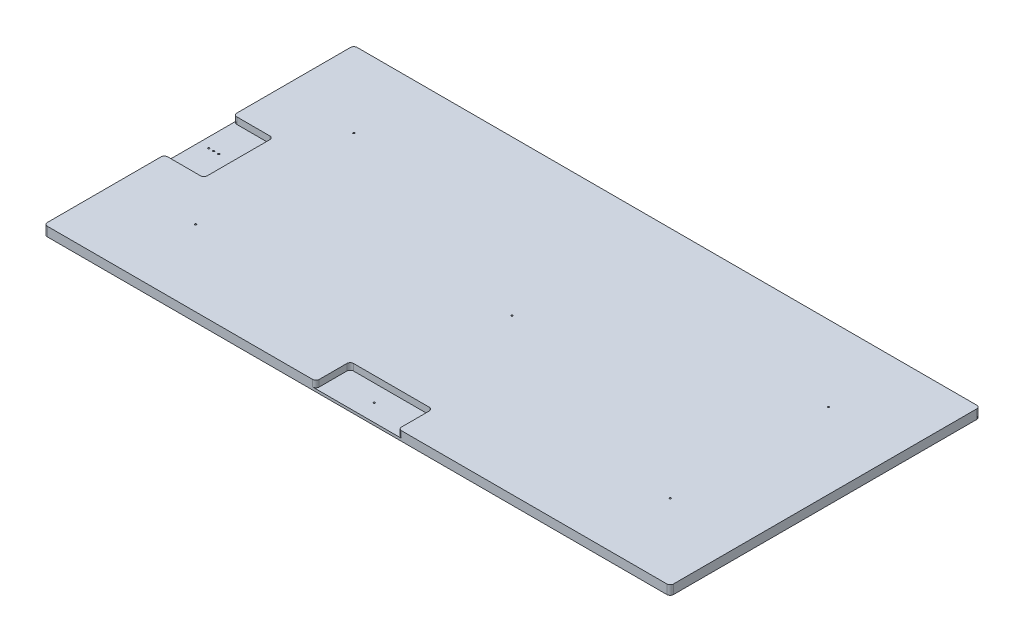
from build123d import *

# Parameters (mm, degrees)
SKETCH1_W                             = 1206.5
SKETCH1_H                             = 596.9
BOSS_EXTRUDE1_DEPTH                   = 17.78
F_1_8_0_125_DIAMETER_HOLE1_D          = 3.175
FILLET1_R                             = 6.35
SKETCH4_W                             = 158.75
SKETCH4_H                             = 66.04
SKETCH4_W_2                           = 76.2
SKETCH4_H_2                           = 133.35
CUT_EXTRUDE1_DEPTH                    = 12.7
FILLET2_R                             = 6.35
SKETCH6_W                             = 1.5875
SKETCH6_H                             = 5.08
F_1_8_0_125_DIAMETER_HOLE2_AT_2_COUNT = 2
F_1_8_0_125_DIAMETER_HOLE2_AT_2_PITCH = 1123.95
F_1_8_0_125_DIAMETER_HOLE2_AT_3_COUNT = 2
F_1_8_0_125_DIAMETER_HOLE2_AT_3_PITCH = 1133.602
F_1_8_0_125_DIAMETER_HOLE2_AT_4_COUNT = 2
F_1_8_0_125_DIAMETER_HOLE2_AT_4_PITCH = 1143.254
F_1_8_0_125_DIAMETER_HOLE2_AT_5_COUNT = 2
F_1_8_0_125_DIAMETER_HOLE2_AT_5_PITCH = 618.636019724
F_1_8_0_125_DIAMETER_HOLE2_AT_6_COUNT = 2
F_1_8_0_125_DIAMETER_HOLE2_AT_6_PITCH = 19.05
F_1_8_0_125_DIAMETER_HOLE2_AT_7_COUNT = 2
F_1_8_0_125_DIAMETER_HOLE2_AT_7_PITCH = 9.525


with BuildPart() as part:
    # Sketch1 → Boss-Extrude1 (new body)
    with BuildSketch(Plane(origin=(0, 0, 0), x_dir=(1, 0, 0), z_dir=(0, 1, 0))):
        Rectangle(SKETCH1_W, SKETCH1_H)
    extrude(amount=BOSS_EXTRUDE1_DEPTH)

    # 1/8 (0.125) Diameter Hole1 (through all)
    with Locations(Plane(origin=(0, 17.78, 0), x_dir=(1, 0, 0), z_dir=(0, 1, 0))):
        with Locations((0, 0), (457.2, 152.4), (-457.2, -152.4), (-457.2, 152.4), (457.2, -152.4)):
            Hole(F_1_8_0_125_DIAMETER_HOLE1_D / 2)

    # Fillet1
    fillet1_edges = [part.edges().sort_by_distance(p)[0] for p in [
        (603.25, 8.89, 298.45),
        (-603.25, 8.89, 298.45),
        (-603.25, 8.89, -298.45),
        (603.25, 8.89, -298.45),
    ]]
    fillet(fillet1_edges, radius=FILLET1_R)

    # Sketch4 → Cut-Extrude1 (cut)
    with BuildSketch(Plane(origin=(0, 17.78, 0), x_dir=(1, 0, 0), z_dir=(0, 1, 0))):
        with Locations((0, -265.43)):
            Rectangle(SKETCH4_W, SKETCH4_H)
        with Locations((-565.15, 0)):
            Rectangle(SKETCH4_W_2, SKETCH4_H_2)
    extrude(amount=-CUT_EXTRUDE1_DEPTH, mode=Mode.SUBTRACT)

    # Fillet2
    fillet2_edges = [part.edges().sort_by_distance(p)[0] for p in [
        (79.375, 11.43, 232.41),
        (79.375, 11.43, 298.45),
        (-79.375, 11.43, 298.45),
        (-79.375, 11.43, 232.41),
        (-603.25, 11.43, 66.675),
        (-603.25, 11.43, -66.675),
        (-527.05, 11.43, -66.675),
        (-527.05, 11.43, 66.675),
    ]]
    fillet(fillet2_edges, radius=FILLET2_R)

    # Sketch6 → 1/8 (0.125) Diameter Hole2 (revolve, cut)
    with BuildSketch(Plane(origin=(558.8, 5.08, 0), x_dir=(0, 0, 1), z_dir=(1, 0, 0))):
        with Locations((0.79375, 2.54)):
            Rectangle(SKETCH6_W, SKETCH6_H)
    f_1_8_0_125_diameter_hole2 = revolve(axis=Axis((558.8, 11.43, 0), (0, -1, 0)), mode=Mode.SUBTRACT)

    # 1/8 (0.125) Diameter Hole2 at 2: 1/8 (0.125) Diameter Hole2 ×2
    with Locations(*[(-i * F_1_8_0_125_DIAMETER_HOLE2_AT_2_PITCH, 0, 0) for i in range(1, F_1_8_0_125_DIAMETER_HOLE2_AT_2_COUNT)]):
        add(f_1_8_0_125_diameter_hole2, mode=Mode.SUBTRACT)

    # 1/8 (0.125) Diameter Hole2 at 3: 1/8 (0.125) Diameter Hole2 ×2
    with Locations(*[(-i * F_1_8_0_125_DIAMETER_HOLE2_AT_3_PITCH, 0, 0) for i in range(1, F_1_8_0_125_DIAMETER_HOLE2_AT_3_COUNT)]):
        add(f_1_8_0_125_diameter_hole2, mode=Mode.SUBTRACT)

    # 1/8 (0.125) Diameter Hole2 at 4: 1/8 (0.125) Diameter Hole2 ×2
    with Locations(*[(-i * F_1_8_0_125_DIAMETER_HOLE2_AT_4_PITCH, 0, 0) for i in range(1, F_1_8_0_125_DIAMETER_HOLE2_AT_4_COUNT)]):
        add(f_1_8_0_125_diameter_hole2, mode=Mode.SUBTRACT)

    # 1/8 (0.125) Diameter Hole2 at 5: 1/8 (0.125) Diameter Hole2 ×2
    with Locations(*[Vector(-0.9032775043542898, 0, 0.4290568145682877) * (i * F_1_8_0_125_DIAMETER_HOLE2_AT_5_PITCH) for i in range(1, F_1_8_0_125_DIAMETER_HOLE2_AT_5_COUNT)]):
        add(f_1_8_0_125_diameter_hole2, mode=Mode.SUBTRACT)

    # 1/8 (0.125) Diameter Hole2 at 6: 1/8 (0.125) Diameter Hole2 ×2
    with Locations(*[(i * F_1_8_0_125_DIAMETER_HOLE2_AT_6_PITCH, 0, 0) for i in range(1, F_1_8_0_125_DIAMETER_HOLE2_AT_6_COUNT)]):
        add(f_1_8_0_125_diameter_hole2, mode=Mode.SUBTRACT)

    # 1/8 (0.125) Diameter Hole2 at 7: 1/8 (0.125) Diameter Hole2 ×2
    with Locations(*[(i * F_1_8_0_125_DIAMETER_HOLE2_AT_7_PITCH, 0, 0) for i in range(1, F_1_8_0_125_DIAMETER_HOLE2_AT_7_COUNT)]):
        add(f_1_8_0_125_diameter_hole2, mode=Mode.SUBTRACT)


solid = part.part
